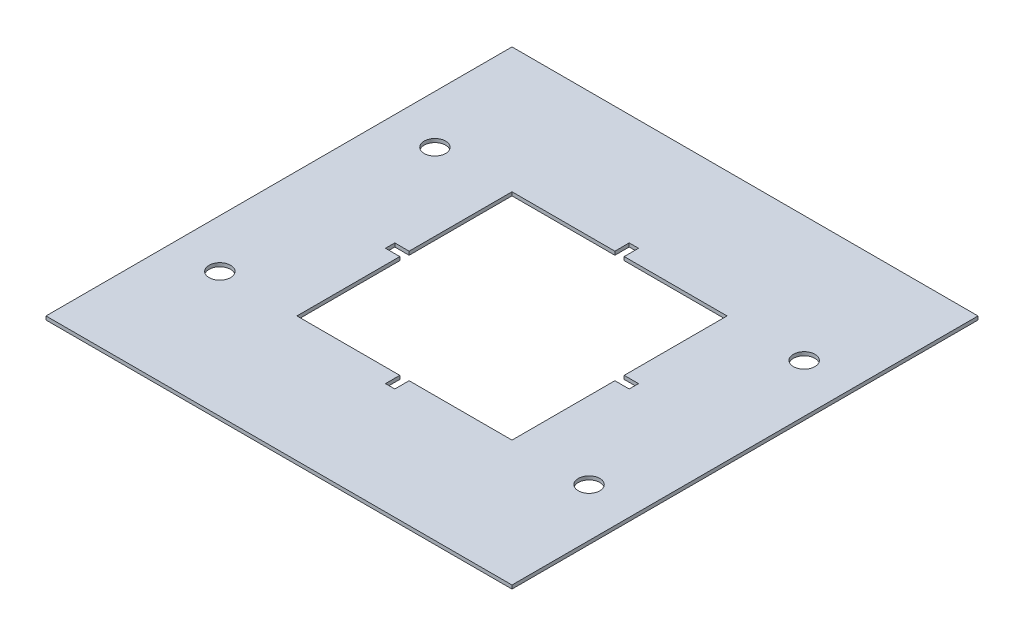
from build123d import *

# Parameters (mm, degrees)
CROQUIS1_W              = 55
CROQUIS1_H              = 55
CROQUIS1_R              = 1.5
SALIENTE_EXTRUIR1_DEPTH = 0.5
CROQUIS2_W              = 65
CROQUIS2_H              = 65
CROQUIS2_W_2            = 55
CROQUIS2_H_2            = 55
SALIENTE_EXTRUIR2_DEPTH = 0.5


with BuildPart() as part:
    # Croquis1 → Saliente-Extruir1 (new body)
    with BuildSketch(Plane(origin=(0, 0, 0), x_dir=(1, 0, 0), z_dir=(0, 1, 0))):
        with Locations((27.5, 27.5)):
            Rectangle(CROQUIS1_W, CROQUIS1_H)
        with Locations(Location((1.75, 42.5, 0), (0, 0, 270))):
            Circle(CROQUIS1_R, mode=Mode.SUBTRACT)
        with Locations(Location((1.75, 12.5, 0), (0, 0, 270))):
            Circle(CROQUIS1_R, mode=Mode.SUBTRACT)
        with Locations(Location((53.25, 42.5, 0), (0, 0, 90))):
            Circle(CROQUIS1_R, mode=Mode.SUBTRACT)
        with Locations(Location((53.25, 12.5, 0), (0, 0, 90))):
            Circle(CROQUIS1_R, mode=Mode.SUBTRACT)
        Polygon((12.5, 12.5), (26.85, 12.5), (26.85, 10.5), (28.15, 10.5), (28.15, 12.5), (42.5, 12.5), (42.5, 26.85), (44.5, 26.85), (44.5, 28.15), (42.5, 28.15), (42.5, 42.5), (28.15, 42.5), (28.15, 44.5), (26.85, 44.5), (26.85, 42.5), (12.5, 42.5), (12.5, 28.15), (10.5, 28.15), (10.5, 26.85), (12.5, 26.85), align=None, mode=Mode.SUBTRACT)
    extrude(amount=SALIENTE_EXTRUIR1_DEPTH)

    # Croquis2 → Saliente-Extruir2 (add)
    with BuildSketch(Plane(origin=(0, 0.5, 0), x_dir=(1, 0, 0), z_dir=(0, 1, 0))):
        with Locations((27.5, 27.5)):
            Rectangle(CROQUIS2_W, CROQUIS2_H)
        with Locations((27.5, 27.5)):
            Rectangle(CROQUIS2_W_2, CROQUIS2_H_2, mode=Mode.SUBTRACT)
    extrude(amount=-SALIENTE_EXTRUIR2_DEPTH)


solid = part.part
